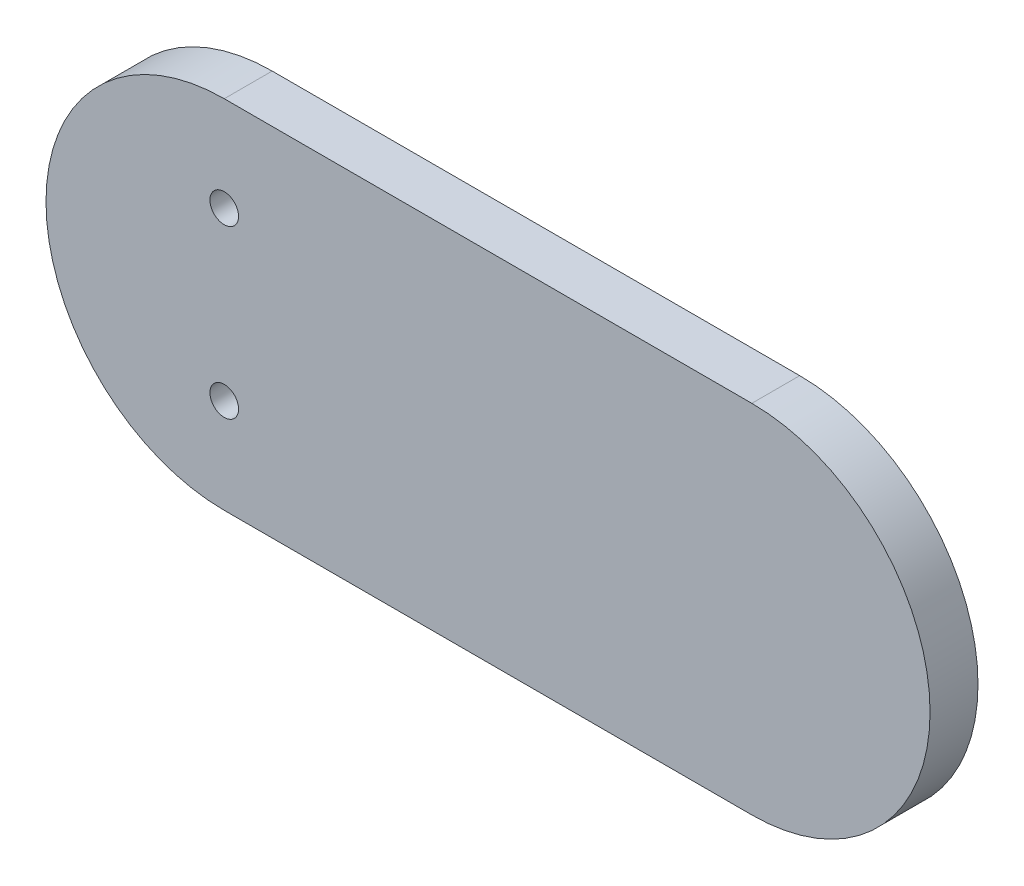
from build123d import *

# Parameters (mm, degrees)
BOSS_EXTRUDE1_DEPTH = 1.59
SKETCH4_R           = 0.95
CUT_EXTRUDE1_DEPTH  = 10


with BuildPart() as part:
    # Sketch3 → Boss-Extrude1 (new, symmetric)
    with BuildSketch(Plane.XY):
        with BuildLine():
            Line((-17.5, 11.825), (17.5, 11.825))
            ThreePointArc((17.5, 11.825), (29.325, 0), (17.5, -11.825))
            Line((17.5, -11.825), (-17.5, -11.825))
            ThreePointArc((-17.5, -11.825), (-29.325, 0), (-17.5, 11.825))
        make_face()
    extrude(amount=BOSS_EXTRUDE1_DEPTH, both=True)

    # Sketch4 → Cut-Extrude1 (cut)
    with BuildSketch(Plane.XY.offset(1.59)):
        with Locations((-17.5, 5.535)):
            Circle(SKETCH4_R)
        with Locations((-17.5, -5.535)):
            Circle(SKETCH4_R)
    extrude(amount=-CUT_EXTRUDE1_DEPTH, mode=Mode.SUBTRACT)


solid = part.part
